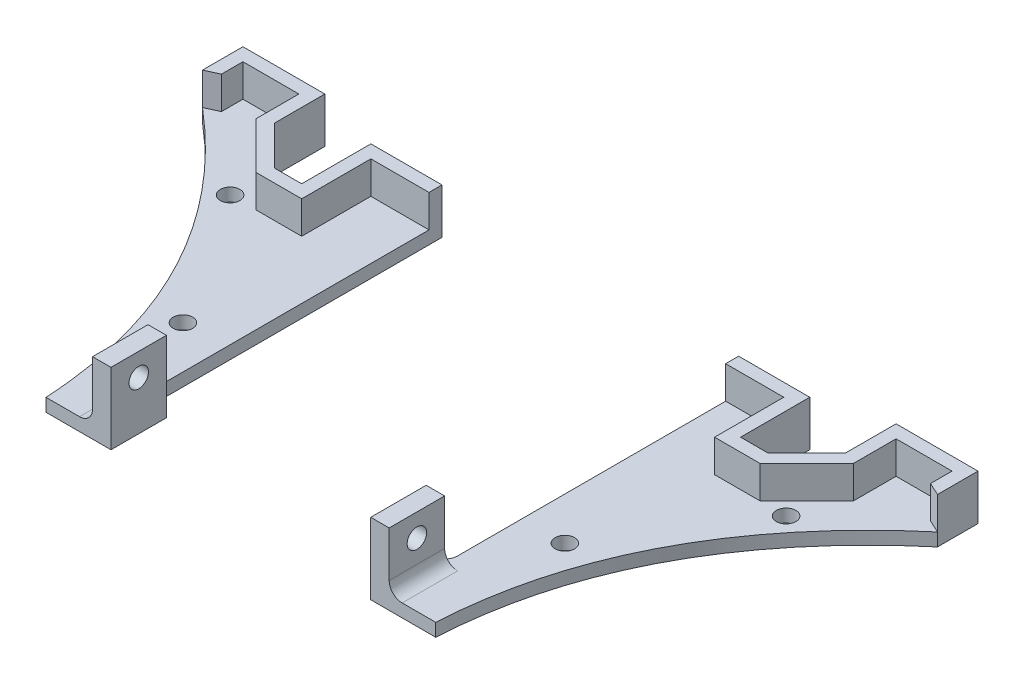
from build123d import *

# Parameters (mm, degrees)
BOSS_EXTRUDE1_DEPTH   = 2
BOSS_EXTRUDE1_2_DEPTH = 2
BOSS_EXTRUDE3_DEPTH   = 5
SKETCH3_R             = 1.5
CUT_EXTRUDE1_DEPTH    = 2
SKETCH5_W             = 2.84
SKETCH5_H             = 8.54
BOSS_EXTRUDE4_DEPTH   = 11
FILLET1_R             = 2
FILLET2_R             = 2
FILLET3_R             = 2
FILLET4_R             = 2
CUT_EXTRUDE3_REACH    = 87.082
SKETCH6_R             = 1.5


with BuildPart() as part:
    # Sketch1 → Boss-Extrude1 (new body)
    with BuildSketch(Plane(origin=(0, 0, 0), x_dir=(1, 0, 0), z_dir=(0, 1, 0))):
        with BuildLine():
            Line((-56.588314529, 22.22458238), (-56.588314529, 28.455124303))
            Line((-56.588314529, 28.455124303), (-43.97594504, 28.455124303))
            Line((-43.97594504, 28.455124303), (-43.97594504, 20.699262249))
            Line((-43.97594504, 20.699262249), (-37.97594504, 14.699262249))
            Line((-37.97594504, 14.699262249), (-33.787864348, 14.699262249))
            Line((-33.787864348, 14.699262249), (-33.787864348, 25.351696057))
            Line((-33.787864348, 25.351696057), (-22.836136218, 25.351696057))
            Line((-22.836136218, 25.351696057), (-22.836136218, -28.455124303))
            Line((-22.836136218, -28.455124303), (-30, -28.455124303))
            add(Edge.make_bspline(
                [(-30, -28.455124303), (-31.631264416, 1.062189743), (-56.588314529, 22.22458238)],
                knots=[0, 0, 0, 1, 1, 1], degree=2))
        make_face()
    extrude(amount=BOSS_EXTRUDE1_DEPTH)



with BuildPart() as body_2:
    # Sketch1 → Boss-Extrude1 2 (new body)
    with BuildSketch(Plane(origin=(0, 0, 0), x_dir=(1, 0, 0), z_dir=(0, 1, 0))):
        with BuildLine():
            Line((33.787864348, 25.351696057), (33.787864348, 14.699262249))
            Line((33.787864348, 14.699262249), (37.97594504, 14.699262249))
            Line((37.97594504, 14.699262249), (43.97594504, 20.699262249))
            Line((43.97594504, 20.699262249), (43.97594504, 28.455124303))
            Line((43.97594504, 28.455124303), (56.588314529, 28.455124303))
            Line((56.588314529, 28.455124303), (56.588314529, 22.22458238))
            add(Edge.make_bspline(
                [(30, -28.455124303), (31.631264416, 1.062189743), (56.588314529, 22.22458238)],
                knots=[0, 0, 0, 1, 1, 1], degree=2))
            Line((30, -28.455124303), (22.836136218, -28.455124303))
            Line((22.836136218, -28.455124303), (22.836136218, 25.351696057))
            Line((22.836136218, 25.351696057), (33.787864348, 25.351696057))
        make_face()
    extrude(amount=BOSS_EXTRUDE1_2_DEPTH)


with BuildPart() as part_1:
    add(part.part)

    add(body_2.part)  # Boss-Extrude3 merges body 2
    # Sketch2 → Boss-Extrude3 (add)
    with BuildSketch(Plane(origin=(0, 2, 0), x_dir=(1, 0, 0), z_dir=(0, 1, 0))):
        Polygon((-54.588314537, 23.145309778), (-56.588314538, 22.224582387), (-56.588314529, 28.455124303), (-43.97594504, 28.455124303), (-43.97594504, 20.699262249), (-37.97594504, 14.699262249), (-33.787864348, 14.699262249), (-33.787864348, 25.351696057), (-22.836136218, 25.351696057), (-22.836136218, 23.351696057), (-31.787864348, 23.351696057), (-31.787864348, 12.699262249), (-38.804372164, 12.699262249), (-45.97594504, 19.870835124), (-45.97594504, 26.455124303), (-54.588314532, 26.455124303), align=None)
        Polygon((22.836136218, 23.351696057), (22.836136218, 25.351696057), (33.787864348, 25.351696057), (33.787864348, 14.699262249), (37.97594504, 14.699262249), (43.97594504, 20.699262249), (43.97594504, 28.455124303), (56.588314529, 28.455124303), (56.588314538, 22.224582387), (54.588314537, 23.145309778), (54.588314532, 26.455124303), (45.97594504, 26.455124303), (45.97594504, 19.870835124), (38.804372164, 12.699262249), (31.787864348, 12.699262249), (31.787864348, 23.351696057), align=None)
    extrude(amount=BOSS_EXTRUDE3_DEPTH)

    # Sketch3 → Cut-Extrude1 (cut)
    with BuildSketch(Plane.XZ):
        with Locations(Location((-29.402732237, 7.966381693, 0), (0, 0, 270))):
            Circle(SKETCH3_R)
        with Locations(Location((-42.805062712, -12.698804379, 0), (0, 0, 270))):
            Circle(SKETCH3_R)
        with Locations(Location((29.402732237, 7.966381693, 0), (0, 0, 270))):
            Circle(SKETCH3_R)
        with Locations(Location((42.805062712, -12.698804379, 0), (0, 0, 270))):
            Circle(SKETCH3_R)
    extrude(amount=-CUT_EXTRUDE1_DEPTH, mode=Mode.SUBTRACT)

    # Sketch5 → Boss-Extrude4 (add)
    with BuildSketch(Plane(origin=(0, 0, 0), x_dir=(1, 0, 0), z_dir=(0, 1, 0))):
        with Locations((-21.416136218, -24.185124303)):
            Rectangle(SKETCH5_W, SKETCH5_H)
        with Locations((21.416136218, -24.185124303)):
            Rectangle(SKETCH5_W, SKETCH5_H)
    extrude(amount=BOSS_EXTRUDE4_DEPTH)

    # Fillet1
    fillet1_edges = [part_1.edges().sort_by_distance(p)[0] for p in [
        (-22.836136218, 2, 24.185124303),
    ]]
    fillet(fillet1_edges, radius=FILLET1_R)

    # Fillet2
    fillet2_edges = [part_1.edges().sort_by_distance(p)[0] for p in [
        (-22.836136218, 1, 19.915124303),
    ]]
    fillet(fillet2_edges, radius=FILLET2_R)

    # Fillet3
    fillet3_edges = [part_1.edges().sort_by_distance(p)[0] for p in [
        (22.836136218, 2, 24.185124303),
    ]]
    fillet(fillet3_edges, radius=FILLET3_R)

    # Fillet4
    fillet4_edges = [part_1.edges().sort_by_distance(p)[0] for p in [
        (22.836136218, 1, 19.915124303),
    ]]
    fillet(fillet4_edges, radius=FILLET4_R)

    # Cut-Extrude3: up to this face of the body (flat: up to its plane)
    cut_extrude3_end = Plane(part_1.part.faces().sort_by_distance((-22.836136218, 7.5, 24.185124303))[0])
    # Sketch6 → Cut-Extrude3 (cut, up to the picked face)
    with BuildSketch(Plane(origin=(22.836136218, 0, 0), x_dir=(0, 0, -1), z_dir=(1, 0, 0)), mode=Mode.PRIVATE) as cut_extrude3_sk1:
        with Locations((-24.185124303, 7.5)):
            Circle(SKETCH6_R)
    cut_extrude3_tool1 = split(extrude(cut_extrude3_sk1.sketch, amount=-CUT_EXTRUDE3_REACH, mode=Mode.PRIVATE), bisect_by=cut_extrude3_end, keep=Keep.BOTH, mode=Mode.PRIVATE)
    add(cut_extrude3_tool1.solids().sort_by(Axis((22.836136, 7.5, 24.185124), (-1, 0, 0)))[0], mode=Mode.SUBTRACT)


solid = part_1.part
